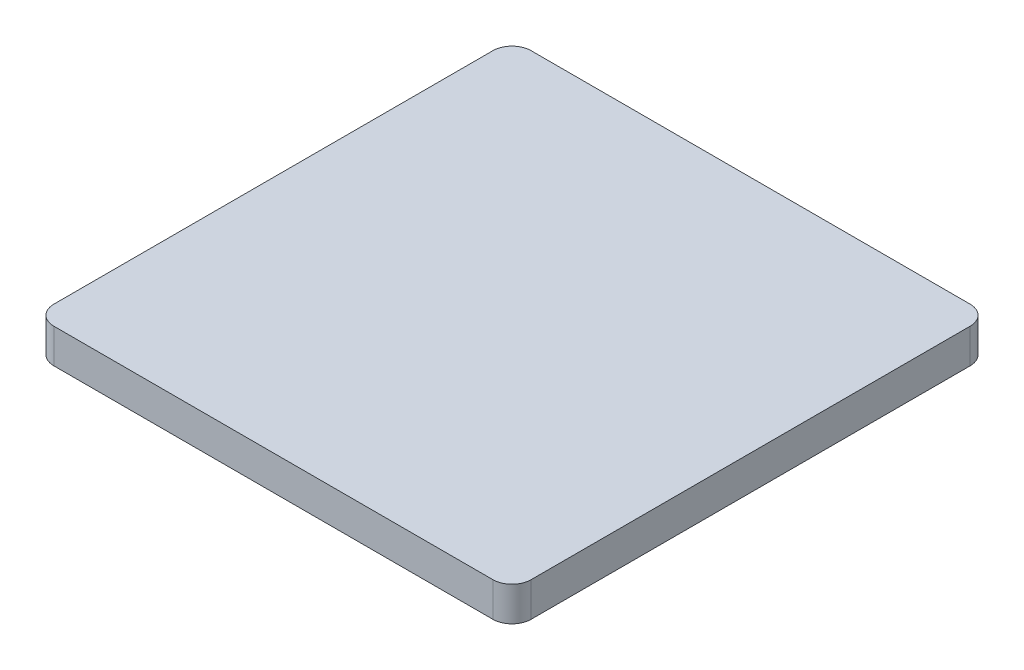
from build123d import *

# Parameters (mm, degrees)
SKETCH_1_W      = 250
SKETCH_1_H      = 250
EXTRUDE_1_DEPTH = 18
FILLET_1_R      = 10


with BuildPart() as part:
    # 草图1 → 凸台-拉伸1 (new body)
    with BuildSketch(Plane(origin=(0, 0, 0), x_dir=(1, 0, 0), z_dir=(0, 1, 0))):
        Rectangle(SKETCH_1_W, SKETCH_1_H)
    extrude(amount=EXTRUDE_1_DEPTH)

    # 圆角1
    fillet_1_edges = [part.edges().sort_by_distance(p)[0] for p in [
        (-125, 9, -125),
        (125, 9, -125),
        (125, 9, 125),
        (-125, 9, 125),
    ]]
    fillet(fillet_1_edges, radius=FILLET_1_R)


solid = part.part
